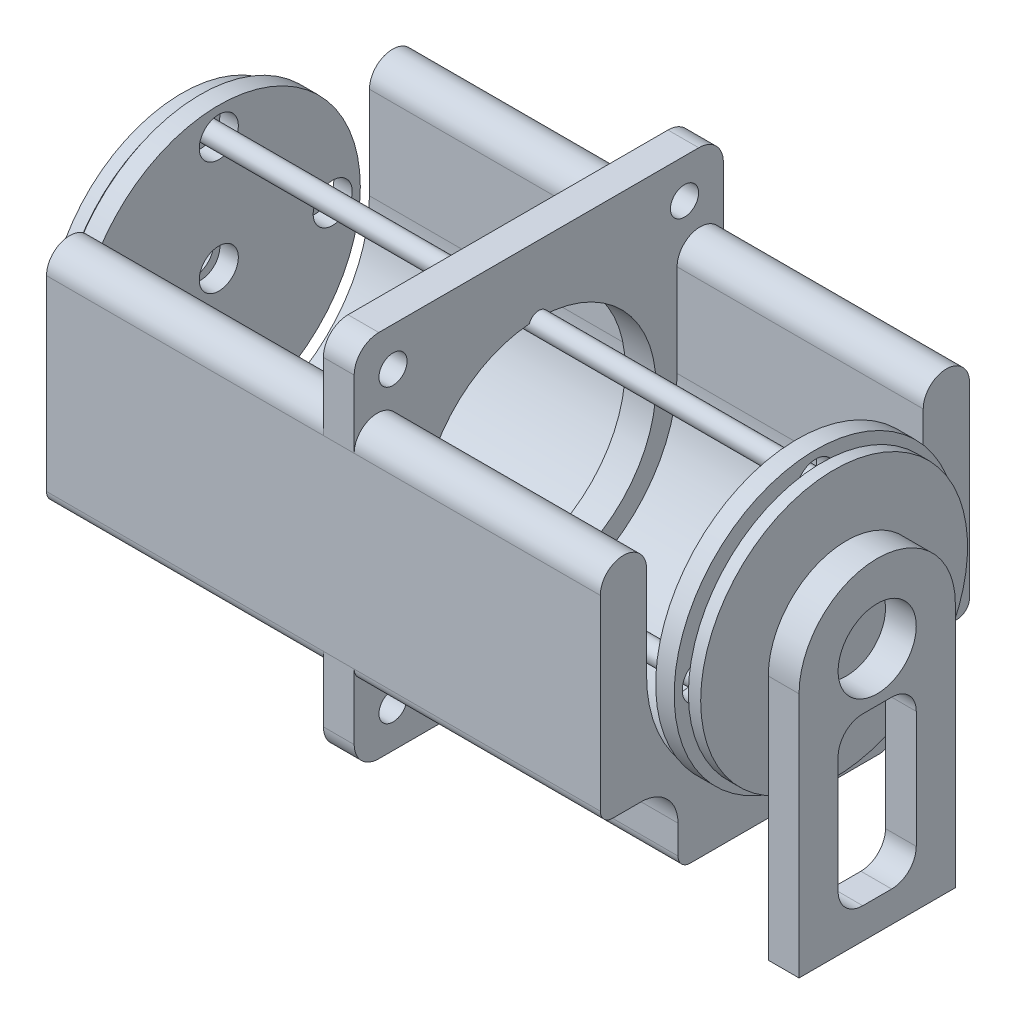
from build123d import *

# Parameters (mm, degrees)
SKETCH1_W              = 60
SKETCH1_H              = 60
SKETCH1_R              = 2.286
SKETCH1_R_2            = 19.05
BOSS_EXTRUDE1_DEPTH    = 5
SKETCH2_R              = 23
SKETCH2_R_2            = 3.175
BOSS_EXTRUDE2_DEPTH    = 3
BOSS_EXTRUDE3_DEPTH    = 90
FILLET1_R              = 2
FILLET3_R              = 4
SKETCH16_R             = 21.6875
SKETCH16_R_2           = 3.175
BOSS_EXTRUDE7_DEPTH    = 2
SKETCH21_R             = 1.5875
BOSS_EXTRUDE11_DEPTH   = 50.8
BOSS_EXTRUDE11_2_DEPTH = 50.8
BOSS_EXTRUDE11_3_DEPTH = 50.8
BOSS_EXTRUDE11_4_DEPTH = 50.8
SKETCH22_R             = 6.35
BOSS_EXTRUDE12_DEPTH   = 5


with BuildPart() as part:
    # Sketch1 → Boss-Extrude1 (new body)
    with BuildSketch(Plane(origin=(0, 0, 0), x_dir=(0, 0, -1), z_dir=(1, 0, 0))):
        Rectangle(SKETCH1_W, SKETCH1_H)
        with Locations((-23.6855, 23.6855)):
            Circle(SKETCH1_R, mode=Mode.SUBTRACT)
        with Locations((23.6855, 23.6855)):
            Circle(SKETCH1_R, mode=Mode.SUBTRACT)
        with Locations((-23.6855, -23.6855)):
            Circle(SKETCH1_R, mode=Mode.SUBTRACT)
        with Locations((23.6855, -23.6855)):
            Circle(SKETCH1_R, mode=Mode.SUBTRACT)
        Circle(SKETCH1_R_2, mode=Mode.SUBTRACT)
    extrude(amount=BOSS_EXTRUDE1_DEPTH)

    # Fillet3
    fillet3_edges = [part.edges().sort_by_distance(p)[0] for p in [
        (2.5, 30, -30),
        (2.5, -30, -30),
        (2.5, -30, 30),
        (2.5, 30, 30),
    ]]
    fillet(fillet3_edges, radius=FILLET3_R)


with BuildPart() as body_2:
    # Sketch2 → Boss-Extrude2 (new body)
    with BuildSketch(Plane(origin=(-50, 0, 0), x_dir=(0, 0, -1), z_dir=(1, 0, 0))):
        Circle(SKETCH2_R)
        Circle(SKETCH2_R_2, mode=Mode.SUBTRACT)
        with Locations((0, 18.5125)):
            Circle(SKETCH2_R_2, mode=Mode.SUBTRACT)
        with Locations((-18.5125, 0)):
            Circle(SKETCH2_R_2, mode=Mode.SUBTRACT)
        with Locations((0, -18.5125)):
            Circle(SKETCH2_R_2, mode=Mode.SUBTRACT)
        with Locations((18.5125, 0)):
            Circle(SKETCH2_R_2, mode=Mode.SUBTRACT)
    extrude(amount=BOSS_EXTRUDE2_DEPTH)


with BuildPart() as body_3:
    # Sketch3 → Boss-Extrude3 (new body)
    with BuildSketch(Plane.ZY.offset(45)):
        with BuildLine():
            Line((-22.48125, 0), (-22.48125, 15))
            ThreePointArc((-22.48125, 15), (-26.240625, 18.759375), (-30, 15))
            Line((-30, 15), (-30, -17.371))
            Line((-30, -17.371), (-23.371, -17.371))
            ThreePointArc((-23.371, -17.371), (-19.128359313, -19.128359313), (-17.371, -23.371))
            Line((-17.371, -23.371), (-17.371, -30))
            Line((-17.371, -30), (17.371, -30))
            Line((17.371, -30), (17.371, -23.371))
            ThreePointArc((17.371, -23.371), (19.128359313, -19.128359313), (23.371, -17.371))
            Line((23.371, -17.371), (30, -17.371))
            Line((30, -17.371), (30, 15))
            ThreePointArc((30, 15), (26.240625, 18.759375), (22.48125, 15))
            Line((22.48125, 15), (22.48125, 0))
            ThreePointArc((22.48125, 0), (0, -22.48125), (-22.48125, 0))
        make_face()
    extrude(amount=-BOSS_EXTRUDE3_DEPTH)

    # Fillet1
    fillet1_edges = [body_3.edges().sort_by_distance(p)[0] for p in [
        (0, -30, 17.371),
        (0, -30, -17.371),
        (0, -17.371, -30),
        (0, -17.371, 30),
    ]]
    fillet(fillet1_edges, radius=FILLET1_R)


with BuildPart() as body_4:
    # Sketch16 → Boss-Extrude7 (new body)
    with BuildSketch(Plane.ZY.offset(53)):
        Circle(SKETCH16_R)
        Circle(SKETCH16_R_2, mode=Mode.SUBTRACT)
    extrude(amount=-BOSS_EXTRUDE7_DEPTH)


with BuildPart() as body_5:
    # Sketch21 → Boss-Extrude11 (new, symmetric)
    with BuildSketch(Plane(origin=(0, 0, 0), x_dir=(0, 0, -1), z_dir=(1, 0, 0))):
        with Locations((-18.5125, 0)):
            Circle(SKETCH21_R)
    extrude(amount=BOSS_EXTRUDE11_DEPTH, both=True)


with BuildPart() as body_6:
    # Sketch21 → Boss-Extrude11 2 (new, symmetric)
    with BuildSketch(Plane(origin=(0, 0, 0), x_dir=(0, 0, -1), z_dir=(1, 0, 0))):
        with Locations((0, 18.5125)):
            Circle(SKETCH21_R)
    extrude(amount=BOSS_EXTRUDE11_2_DEPTH, both=True)


with BuildPart() as body_7:
    # Sketch21 → Boss-Extrude11 3 (new, symmetric)
    with BuildSketch(Plane(origin=(0, 0, 0), x_dir=(0, 0, -1), z_dir=(1, 0, 0))):
        with Locations((18.5125, 0)):
            Circle(SKETCH21_R)
    extrude(amount=BOSS_EXTRUDE11_3_DEPTH, both=True)


with BuildPart() as body_8:
    # Sketch21 → Boss-Extrude11 4 (new, symmetric)
    with BuildSketch(Plane(origin=(0, 0, 0), x_dir=(0, 0, -1), z_dir=(1, 0, 0))):
        with Locations((0, -18.5125)):
            Circle(SKETCH21_R)
    extrude(amount=BOSS_EXTRUDE11_4_DEPTH, both=True)


with BuildPart() as body_9:
    # Mirror2: mirrored copy
    add(body_2.part.mirror(Plane(origin=(0, 0, 0), x_dir=(0, 0, 1), z_dir=(1, 0, 0))))


with BuildPart() as body_10:
    # Mirror2 2: mirrored copy
    add(body_4.part.mirror(Plane(origin=(0, 0, 0), x_dir=(0, 0, 1), z_dir=(1, 0, 0))))


with BuildPart() as body_11:
    # Sketch22 → Boss-Extrude12 (new body)
    with BuildSketch(Plane(origin=(55, 0, 0), x_dir=(0, 0, -1), z_dir=(1, 0, 0))):
        with BuildLine():
            ThreePointArc((12.7, 0), (0, 12.7), (-12.7, 0))
            Line((-12.7, 0), (-12.7, -40))
            Line((-12.7, -40), (12.7, -40))
            Line((12.7, -40), (12.7, 0))
        make_face()
        with BuildLine():
            Line((-6.35, -31), (-6.35, -12))
            ThreePointArc((-6.35, -12), (-5.178427125, -9.171572875), (-2.35, -8))
            Line((-2.35, -8), (2.35, -8))
            ThreePointArc((2.35, -8), (5.178427125, -9.171572875), (6.35, -12))
            Line((6.35, -12), (6.35, -31))
            ThreePointArc((6.35, -31), (5.178427125, -33.828427125), (2.35, -35))
            Line((2.35, -35), (-2.35, -35))
            ThreePointArc((-2.35, -35), (-5.178427125, -33.828427125), (-6.35, -31))
        make_face(mode=Mode.SUBTRACT)
        Circle(SKETCH22_R, mode=Mode.SUBTRACT)
    extrude(amount=BOSS_EXTRUDE12_DEPTH)


solid = Compound([part.part, body_2.part, body_3.part, body_4.part, body_5.part, body_6.part, body_7.part, body_8.part, body_9.part, body_10.part, body_11.part])
